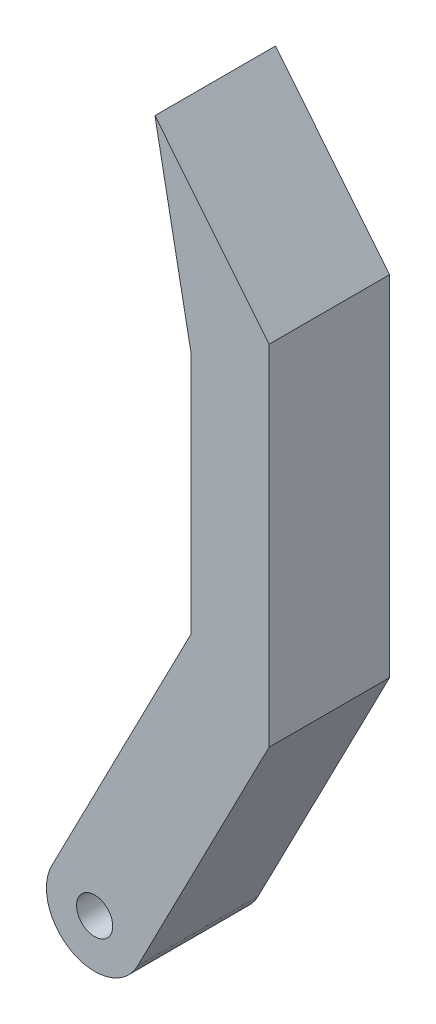
from build123d import *

# Parameters (mm, degrees)
SKETCH_1_R      = 1.5
EXTRUDE_1_DEPTH = 10


with BuildPart() as part:
    # 草图1 → 凸台-拉伸1 (new body)
    with BuildSketch(Plane.XY):
        with BuildLine():
            Line((8, 44.424510324), (8, 24.249761918))
            Line((8, 24.249761918), (-3.555429037, 1.832736851))
            ThreePointArc((-3.555429037, 1.832736851), (-1.832736851, -3.555429037), (3.555429037, -1.832736851))
            Line((3.555429037, -1.832736851), (3.554621026, -1.832320341))
            Line((3.554621026, -1.832320341), (3.593691894, -1.756524572))
            Line((3.593691894, -1.756524572), (14.47, 19.343035702))
            Line((14.47, 19.343035702), (14.47, 48.303035702))
            Line((14.47, 48.303035702), (5.002811382, 60.002387807))
            Line((5.002811382, 60.002387807), (8, 44.424510324))
        make_face()
        Circle(SKETCH_1_R, mode=Mode.SUBTRACT)
    extrude(amount=EXTRUDE_1_DEPTH)


solid = part.part
